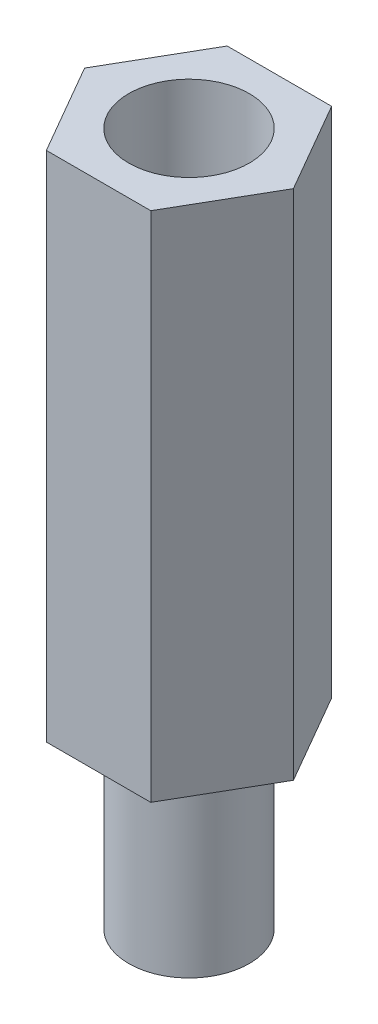
from build123d import *

# Parameters (mm, degrees)
SKETCH_2_R      = 2
EXTRUDE_1_DEPTH = 17
SKETCH_2_2_R    = 2
EXTRUDE_2_DEPTH = 6


with BuildPart() as part:
    # 草图2 → 凸台-拉伸1 (new body)
    with BuildSketch(Plane(origin=(0, 0, 0), x_dir=(1, 0, 0), z_dir=(0, 1, 0))):
        Polygon((3.464101615, 0), (1.732050808, 3), (-1.732050808, 3), (-3.464101615, 0), (-1.732050808, -3), (1.732050808, -3), align=None)
        Circle(SKETCH_2_R, mode=Mode.SUBTRACT)
    extrude(amount=EXTRUDE_1_DEPTH)


with BuildPart() as body_2:
    # 草图2<2> → 凸台-拉伸2 (new body)
    with BuildSketch(Plane(origin=(0, 0, 0), x_dir=(1, 0, 0), z_dir=(0, 1, 0))):
        Circle(SKETCH_2_2_R)
    extrude(amount=-EXTRUDE_2_DEPTH)


solid = Compound([part.part, body_2.part])
